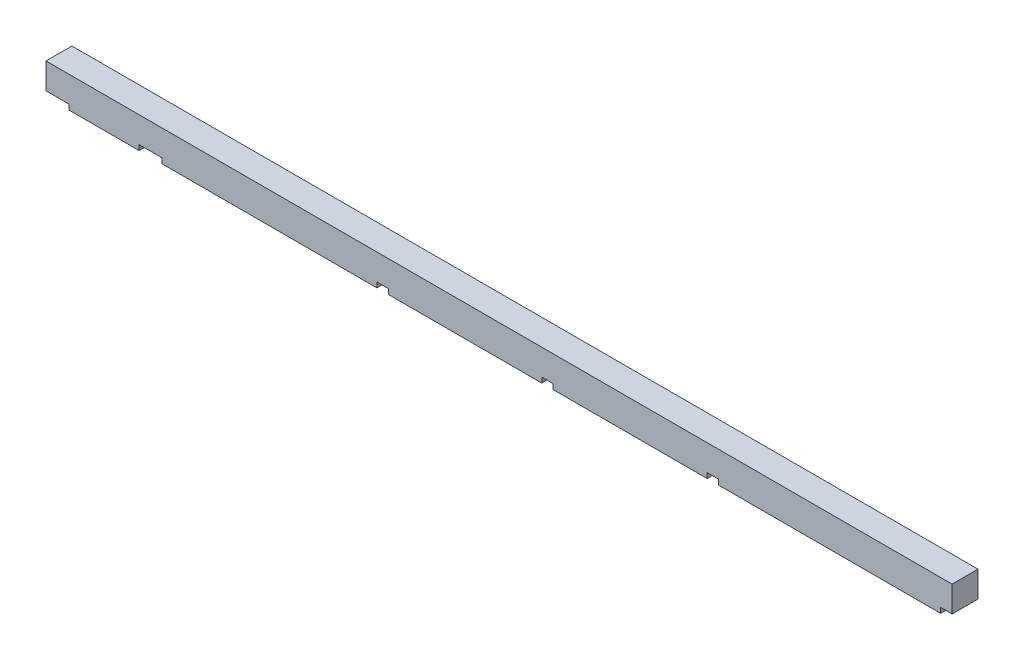
from build123d import *

# Parameters (mm, degrees)
EXTRUDE_1_DEPTH = 5


with BuildPart() as part:
    # Model → 凸台-拉伸1 (new body)
    with BuildSketch(Plane.XY):
        Polygon((67.236808621, 3.639203016), (69.436808621, 3.639203016), (69.436808621, 2.639203016), (99.083381953, 2.639203016), (99.083381953, 3.639203016), (101.283381953, 3.639203016), (101.283381953, 2.639203016), (131.03665326, 2.639203016), (131.03665326, 3.62337358), (133.236025848, 3.639203016), (133.236025848, 2.639203016), (176.136025848, 2.639203016), (176.136025848, 3.639203016), (178.336025848, 3.639203016), (178.336025848, 8.639203016), (50.336025848, 8.639203016), (3.336025848, 8.639203016), (3.336025848, 3.639203016), (7.736025848, 3.639203016), (7.736025848, 2.639203016), (21.308226604, 2.639203016), (21.308226604, 3.639203016), (25.708226604, 3.639203016), (25.708226604, 2.639203016), (67.236808621, 2.639203016), align=None)
    extrude(amount=EXTRUDE_1_DEPTH)


solid = part.part
